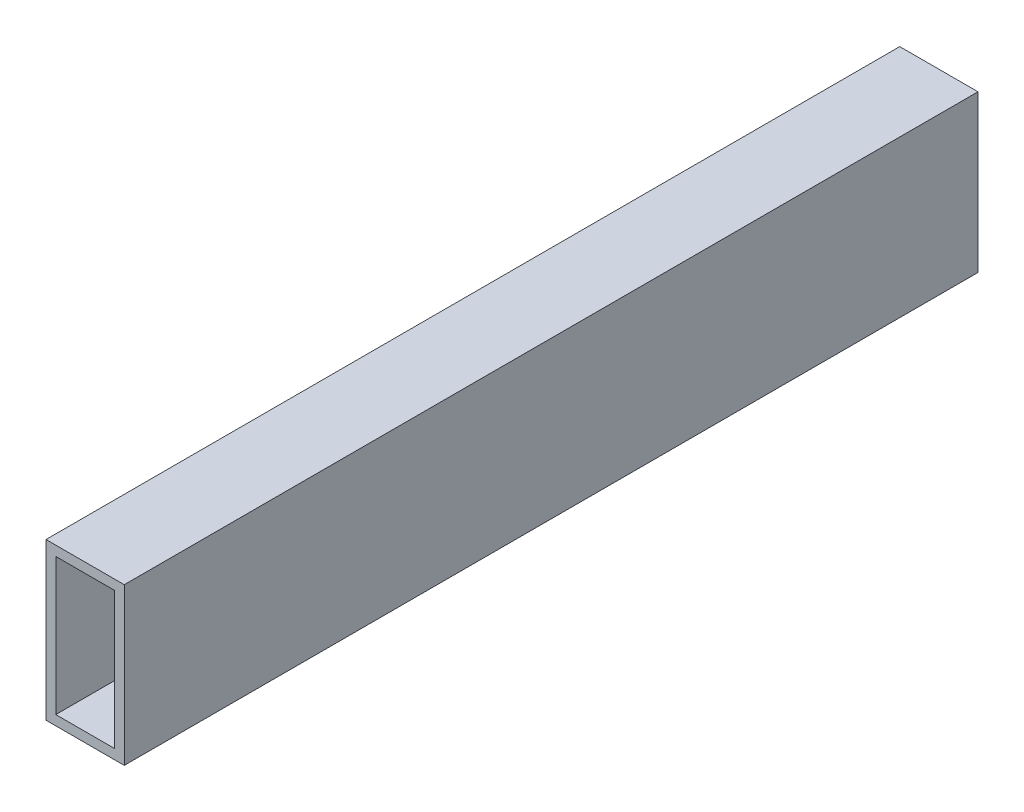
from build123d import *

# Parameters (mm, degrees)
SKETCH1_W           = 25.4
SKETCH1_H           = 50.8
SKETCH1_W_2         = 19.05
SKETCH1_H_2         = 44.45
BOSS_EXTRUDE1_DEPTH = 277.114


with BuildPart() as part:
    # Sketch1 → Boss-Extrude1 (new body)
    with BuildSketch(Plane.XY):
        Rectangle(SKETCH1_W, SKETCH1_H)
        Rectangle(SKETCH1_W_2, SKETCH1_H_2, mode=Mode.SUBTRACT)
    extrude(amount=BOSS_EXTRUDE1_DEPTH)


solid = part.part
